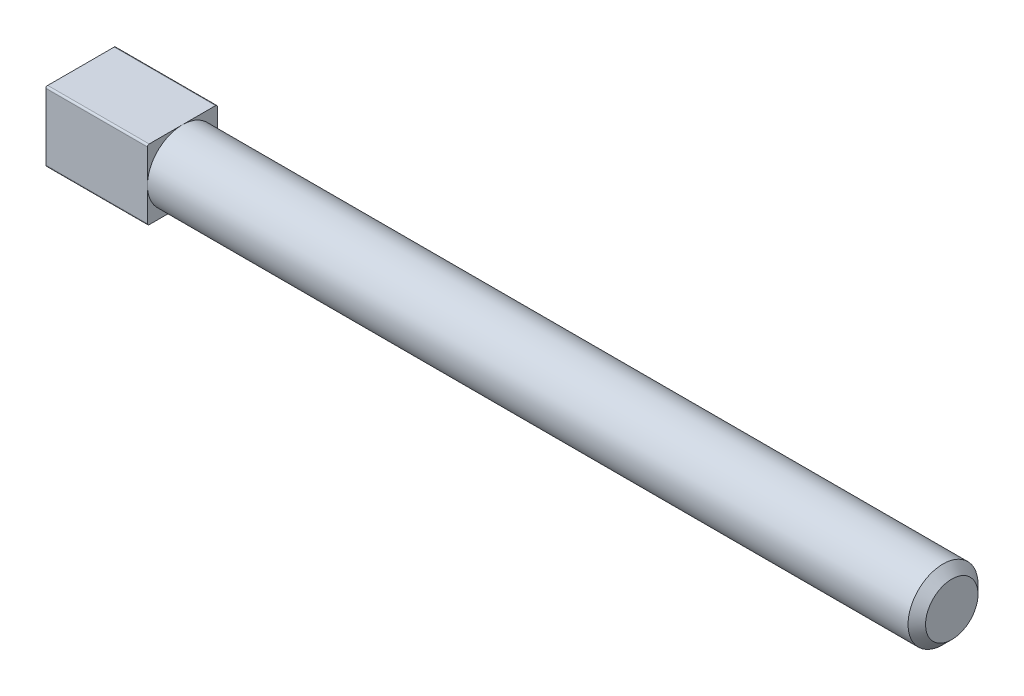
from build123d import *

# Parameters (mm, degrees)
SKETCH_1_W      = 4
SKETCH_1_H      = 4
EXTRUDE_1_DEPTH = 6
SKETCH_2_R      = 2
EXTRUDE_2_DEPTH = 44
CHAMFER_1_SIZE  = 0.5
CHAMFER_2_SIZE  = 0.2
FILLET_1_R      = 0.1


with BuildPart() as part:
    # 草图1 → 凸台-拉伸1 (new body)
    with BuildSketch(Plane(origin=(0, 0, 0), x_dir=(0, 0, -1), z_dir=(1, 0, 0))):
        Rectangle(SKETCH_1_W, SKETCH_1_H)
    extrude(amount=EXTRUDE_1_DEPTH)

    # 草图2 → 凸台-拉伸2 (add)
    with BuildSketch(Plane(origin=(6, 0, 0), x_dir=(0, 0, -1), z_dir=(1, 0, 0))):
        Circle(SKETCH_2_R)
    extrude(amount=EXTRUDE_2_DEPTH)

    # 倒角1
    chamfer_1_edges = [part.edges().sort_by_distance(p)[0] for p in [
        (50, 0, 2),
    ]]
    chamfer(chamfer_1_edges, length=CHAMFER_1_SIZE)

    # 倒角2
    chamfer_2_edges = [part.edges().sort_by_distance(p)[0] for p in [
        (0, 0, 2),
        (0, 2, 0),
        (0, 0, -2),
        (0, -2, 0),
    ]]
    chamfer(chamfer_2_edges, length=CHAMFER_2_SIZE)

    # 圆角1
    fillet_1_edges = [part.edges().sort_by_distance(p)[0] for p in [
        (3.1, -2, 2),
        (3.1, 2, 2),
        (3.1, 2, -2),
        (3.1, -2, -2),
    ]]
    fillet(fillet_1_edges, radius=FILLET_1_R)


solid = part.part
